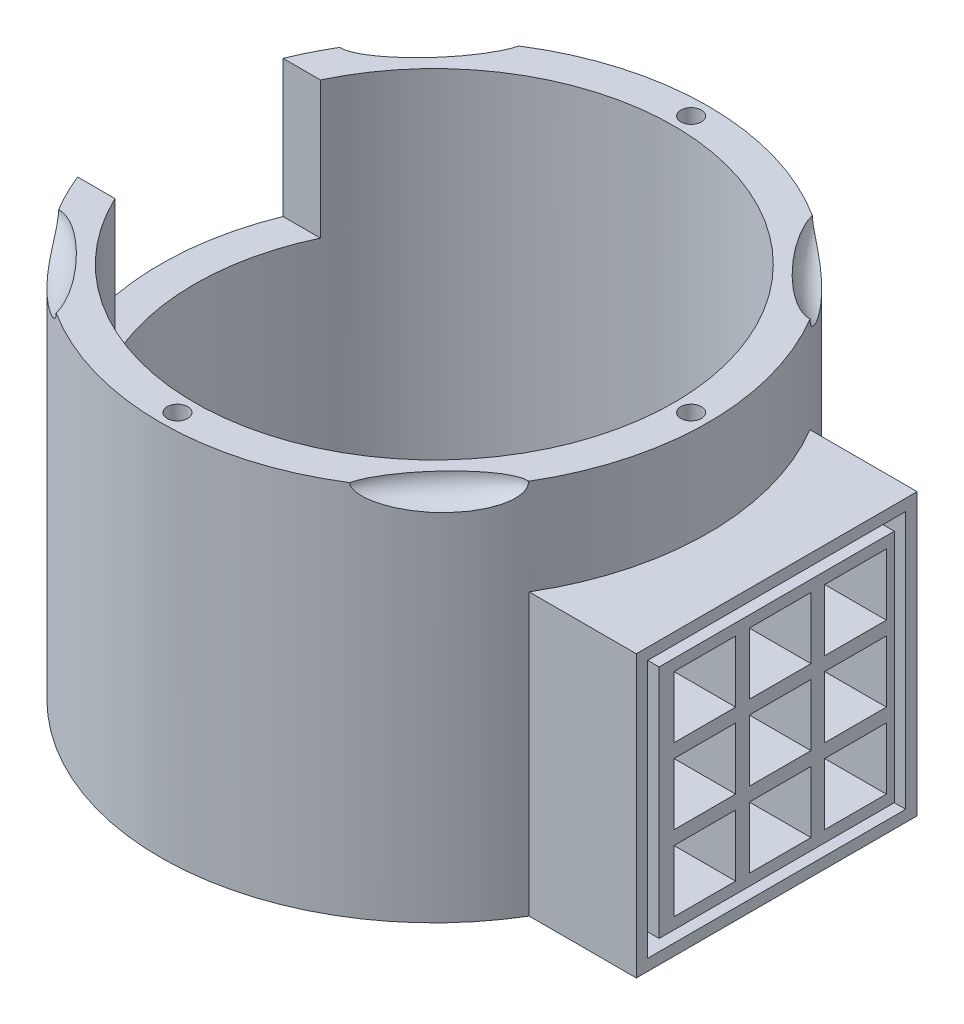
from build123d import *

# Parameters (mm, degrees)
SKETCH2_R                = 50.8
BOSS_EXTRUDE1_DEPTH      = 76.2
CUT_EXTRUDE4_START       = -6.35
SKETCH5_R                = 44.449999999999996
CUT_EXTRUDE4_DEPTH       = 63.5
CUT_EXTRUDE6_REACH       = 106.727
SKETCH14_R               = 7.62
BOSS_EXTRUDE4_REACH      = 170.227
BOSS_EXTRUDE4_END_RADIUS = 50.8
BOSS_EXTRUDE4_START      = 63.5
SKETCH17_W               = 52.06999999999999
SKETCH17_H               = 52.06999999999999
SKETCH15_W               = 11.430000000000003
SKETCH15_H               = 11.430000000000021
CUT_EXTRUDE7_DEPTH       = 112.44204771987995
CUT_EXTRUDE9_DEPTH       = 12.7
CUT_EXTRUDE10_DEPTH      = 112.44204771987995
CUT_EXTRUDE10_DEPTH_BACK = 112.44204771987995
SKETCH22_R               = 1.9049999999999998
SKETCH22_R_2             = 1.905
CUT_EXTRUDE11_DEPTH      = 6.35
CUT_EXTRUDE12_REACH      = 113.442
CUT_EXTRUDE12_END_RADIUS = 50.8


with BuildPart() as part:
    # Sketch2 → Boss-Extrude1 (new body)
    with BuildSketch(Plane(origin=(0, 0, 0), x_dir=(1, 0, 0), z_dir=(0, 1, 0))):
        with Locations(Location((0, 0, 0), (0, 0, 270))):
            Circle(SKETCH2_R)
    extrude(amount=-BOSS_EXTRUDE1_DEPTH)

    # Sketch5 → Cut-Extrude4 (cut)
    with BuildSketch(Plane(origin=(0, 0, 0), x_dir=(1, 0, 0), z_dir=(0, 1, 0)).offset(CUT_EXTRUDE4_START)):
        with Locations(Location((0, 0, 0), (0, 0, 270))):
            Circle(SKETCH5_R)
    extrude(amount=-CUT_EXTRUDE4_DEPTH, mode=Mode.SUBTRACT)

    # Sketch14 → Cut-Extrude6 (cut, up to next)
    with BuildSketch(Plane(origin=(0, 0, 0), x_dir=(1, 0, 0), z_dir=(0, 1, 0)), mode=Mode.PRIVATE) as cut_extrude6_sk1:
        with Locations(Location((0, 0, 0), (0, 0, 270))):
            Circle(SKETCH14_R)
    cut_extrude6_tool1 = extrude(cut_extrude6_sk1.sketch, amount=-CUT_EXTRUDE6_REACH, mode=Mode.PRIVATE) & part.part
    add(cut_extrude6_tool1.solids().sort_by_distance((0, 0, 0))[0], mode=Mode.SUBTRACT)

    # Boss-Extrude4: up to this cylinder (the profile starts outside it)
    boss_extrude4_end = Plane(origin=(0, -50.165, 0), z_dir=(0, 1, 0)) * Cylinder(BOSS_EXTRUDE4_END_RADIUS, 443.054, mode=Mode.PRIVATE)
    # Sketch17 → Boss-Extrude4 (add, up to the surface)
    with BuildSketch(Plane(origin=(0, 0, 0), x_dir=(0, 0, -1), z_dir=(1, 0, 0)).offset(BOSS_EXTRUDE4_START), mode=Mode.PRIVATE) as boss_extrude4_sk1:
        with Locations((0, -50.165000000000006)):
            Rectangle(SKETCH17_W, SKETCH17_H)
    boss_extrude4_tool1 = extrude(boss_extrude4_sk1.sketch, amount=-BOSS_EXTRUDE4_REACH, mode=Mode.PRIVATE) - boss_extrude4_end
    add(boss_extrude4_tool1.solids().sort_by_distance((63.5, -50.165, 0))[0])

    # Sketch15 → Cut-Extrude7 (cut, through all)
    with BuildSketch(Plane(origin=(0, 0, 0), x_dir=(0, 0, -1), z_dir=(1, 0, 0))):
        Polygon((8.890000000000002, -30.480000000000018), (8.890000000000004, -41.91000000000002), (20.320000000000007, -41.91000000000002), (20.320000000000004, -30.480000000000018), align=None)
        Polygon((8.890000000000004, -44.45000000000002), (8.890000000000004, -55.879999999999995), (20.32000000000001, -55.87999999999999), (20.320000000000004, -44.45000000000002), align=None)
        Polygon((8.890000000000004, -58.42000000000001), (8.890000000000006, -69.85000000000002), (20.320000000000007, -69.85000000000002), (20.320000000000004, -58.42000000000001), align=None)
        Polygon((-5.079999999999998, -30.480000000000018), (-5.0799999999999965, -41.91000000000002), (6.350000000000003, -41.91000000000002), (6.3500000000000005, -30.480000000000018), align=None)
        Polygon((-5.0799999999999965, -44.45000000000002), (-5.079999999999994, -55.879999999999995), (6.350000000000005, -55.879999999999995), (6.350000000000002, -44.45000000000002), align=None)
        Polygon((-5.079999999999994, -58.42000000000001), (-5.079999999999992, -69.85000000000002), (6.3500000000000085, -69.85000000000002), (6.350000000000005, -58.42000000000001), align=None)
        with Locations((-13.334999999999996, -64.13500000000002)):
            Rectangle(SKETCH15_W, SKETCH15_H)
        Polygon((-19.049999999999997, -44.45000000000002), (-19.049999999999997, -55.88), (-7.619999999999997, -55.88), (-7.620000000000001, -44.45000000000001), align=None)
        Polygon((-19.049999999999997, -30.480000000000018), (-19.049999999999997, -41.91000000000002), (-7.619999999999997, -41.91000000000002), (-7.619999999999999, -30.480000000000018), align=None)
    extrude(amount=CUT_EXTRUDE7_DEPTH, mode=Mode.SUBTRACT)

    # Sketch19 → Cut-Extrude9 (cut)
    with BuildSketch(Plane(origin=(63.5, 0, 0), x_dir=(0, 0, -1), z_dir=(1, 0, 0))):
        Polygon((-23.91833418, -26.24666582000001), (23.91833418, -26.24666582000001), (23.918334180000006, -74.08333418000001), (-23.918334179999995, -74.08333418000001), align=None)
        Polygon((-21.801668359999997, -28.36333164000001), (21.801668359999997, -28.36333164000001), (21.801668360000008, -71.96666836), (-21.80166835999999, -71.96666836), align=None, mode=Mode.SUBTRACT)
    extrude(amount=-CUT_EXTRUDE9_DEPTH, mode=Mode.SUBTRACT)

    # Sketch21 → Cut-Extrude10 (cut, two sides: drawn at the far end of the back side and taken through both)
    with BuildSketch(Plane.XY.offset(-CUT_EXTRUDE10_DEPTH_BACK)):
        Polygon((-50.8, -5.551e-14), (50.8, -5.551e-14), (50.8, -6.350000000000057), (-50.8, -6.350000000000056), align=None)
    extrude(amount=CUT_EXTRUDE10_DEPTH + CUT_EXTRUDE10_DEPTH_BACK, mode=Mode.SUBTRACT)

    # Sketch22 → Cut-Extrude11 (cut)
    with BuildSketch(Plane(origin=(-1.1e-16, -6.3500000000000565, 0), x_dir=(1, -2e-17, 0), z_dir=(2e-17, 1, 0))):
        with Locations(Location((-47.625, 0, 0), (0, 0, 180))):
            Circle(SKETCH22_R)
        with Locations(Location((-3.47e-15, 47.625, 0), (0, 0, 180))):
            Circle(SKETCH22_R_2)
        with Locations(Location((47.625, -2e-17, 0), (0, 0, 180))):
            Circle(SKETCH22_R)
        with Locations(Location((0, -47.625, 0), (0, 0, 180))):
            Circle(SKETCH22_R)
    extrude(amount=-CUT_EXTRUDE11_DEPTH, mode=Mode.SUBTRACT)

    # Sketch23 → Cut-Revolve2 (revolve, cut)
    with BuildSketch(Plane(origin=(-1.1e-16, -6.3500000000000565, 0), x_dir=(1, -2e-17, 0), z_dir=(2e-17, 1, 0))):
        with BuildLine():
            ThreePointArc((-35.92102448427656, 35.92102448427667), (-40.05586016064811, 31.243688431275256), (-43.58574874724786, 26.094491873607765))
            add(Edge.make_bspline(
                [(-43.58574874724785, 26.09449187360776), (-31.762489950913196, 24.642390713165252), (-27.206529454407143, 42.90040506855935)],
                knots=[0.20326690102876438, 0.20326690102876438, 0.20326690102876438, 2.6184475567908634, 2.6184475567908634, 2.6184475567908634], degree=2, weights=[1, 0.3552729019239298, 1]))
            ThreePointArc((-27.206529454407157, 42.90040506855938), (-31.756101065864836, 39.650851757491644), (-35.92102448427656, 35.921024484276664))
        make_face()
    cut_revolve2 = revolve(axis=Axis((-44.65936804956108, -6.350000000000056, -27.140852507845565), (0.6979571200610449, 0, -0.7161395524310135)), mode=Mode.SUBTRACT)

    # Mirror1: Cut-Revolve2 across plane
    add(cut_revolve2.mirror(Plane.XY), mode=Mode.SUBTRACT)

    # Mirror2: Cut-Revolve2 across plane
    add(cut_revolve2.mirror(Plane(origin=(0, 0, 0), x_dir=(0, 0, 1), z_dir=(1, 0, 0))), mode=Mode.SUBTRACT)

    # Mirror2 copy 1 sketch → Mirror2 copy 1 (revolve, cut)
    with BuildSketch(Plane(origin=(1.1e-16, -6.3500000000000565, 0), x_dir=(-1, -2e-17, 0), z_dir=(-2e-17, 1, 0))):
        with BuildLine():
            ThreePointArc((-35.92102448427656, 35.92102448427667), (-40.05586016064811, 31.243688431275256), (-43.58574874724786, 26.094491873607765))
            add(Edge.make_bspline(
                [(-43.58574874724785, 26.09449187360776), (-31.762489950913196, 24.642390713165252), (-27.206529454407143, 42.90040506855935)],
                knots=[0.20326690102876438, 0.20326690102876438, 0.20326690102876438, 2.6184475567908634, 2.6184475567908634, 2.6184475567908634], degree=2, weights=[1, 0.3552729019239298, 1]))
            ThreePointArc((-27.206529454407157, 42.90040506855938), (-31.756101065864836, 39.650851757491644), (-35.92102448427656, 35.921024484276664))
        make_face()
    revolve(axis=Axis((44.65936804956108, -6.350000000000056, 27.140852507845565), (-0.6979571200610449, 0, 0.7161395524310135)), mode=Mode.SUBTRACT)

    # Cut-Extrude12: up to this cylinder (the profile starts inside it)
    cut_extrude12_end = Plane(origin=(0, -19.049999999999997, 0), z_dir=(0, 1, 0)) * Cylinder(CUT_EXTRUDE12_END_RADIUS, 329.484, mode=Mode.PRIVATE)
    # Sketch24 → Cut-Extrude12 (cut, up to the surface)
    with BuildSketch(Plane(origin=(0, 0, 0), x_dir=(0, 0, -1), z_dir=(1, 0, 0)), mode=Mode.PRIVATE) as cut_extrude12_sk1:
        Polygon((19.05, -6.350000000000049), (-19.050000000000004, -6.350000000000054), (-19.05, -31.750000000000064), (19.050000000000008, -31.75000000000005), align=None)
    cut_extrude12_tool1 = extrude(cut_extrude12_sk1.sketch, amount=-CUT_EXTRUDE12_REACH, mode=Mode.PRIVATE) & cut_extrude12_end
    add(cut_extrude12_tool1.solids().sort_by_distance((0, -19.05, 0))[0], mode=Mode.SUBTRACT)


solid = part.part
